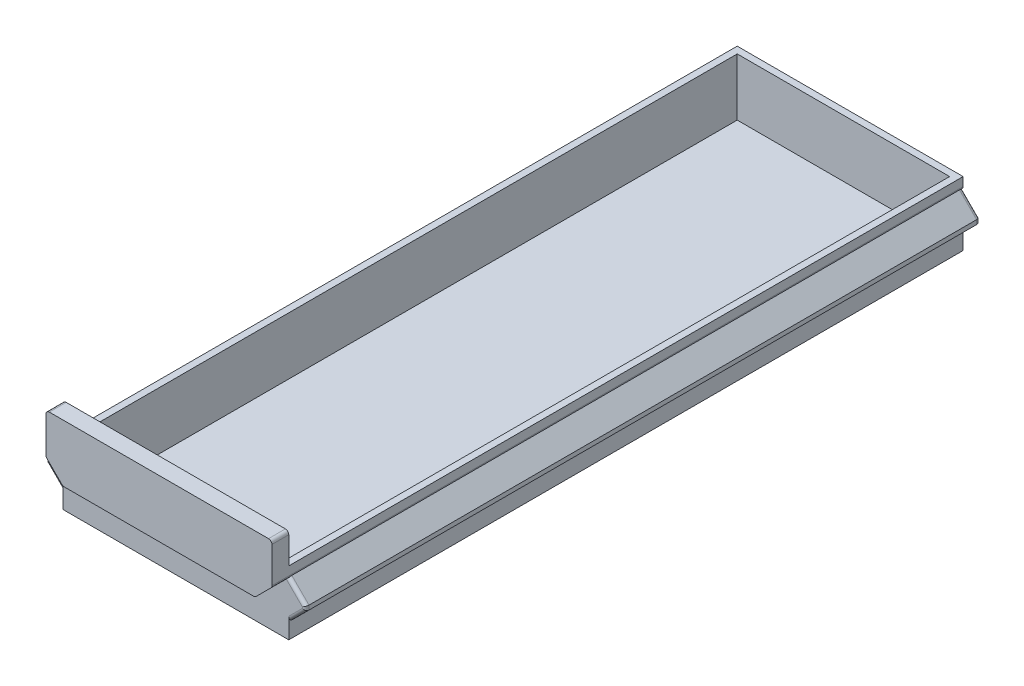
from build123d import *

# Parameters (mm, degrees)
EXTRUDE_1_DEPTH     = 200
SKETCH_2_W          = 63
SKETCH_2_H          = 196
CUT_EXTRUDE_1_DEPTH = 17
SKETCH_4_W          = 67
SKETCH_4_H          = 17
EXTRUDE_2_DEPTH     = 5
CHAMFER_1_SIZE      = 5
FILLET_1_R          = 1
FILLET_3_R          = 1


with BuildPart() as part:
    # 草图1 → 凸台-拉伸1 (new body)
    with BuildSketch(Plane.XY):
        Polygon((-6, 28), (-73, 28), (-73, 32.656854249), (-78, 37.656854249), (-78, 38.928932188), (-73, 43.928932188), (-73, 47), (-6, 47), (-6, 43.928932188), (-1, 38.928932188), (-1, 37.656854249), (-6, 32.656854249), align=None)
    extrude(amount=-EXTRUDE_1_DEPTH)

    # 草图2 → 切除-拉伸1 (cut)
    with BuildSketch(Plane(origin=(0, 47, 0), x_dir=(1, 0, 0), z_dir=(0, 1, 0))):
        with Locations((-39.5, 100)):
            Rectangle(SKETCH_2_W, SKETCH_2_H)
    extrude(amount=-CUT_EXTRUDE_1_DEPTH, mode=Mode.SUBTRACT)

    # 草图4 → 凸台-拉伸2 (add)
    with BuildSketch(Plane.XY):
        with Locations((-39.5, 47.5)):
            Rectangle(SKETCH_4_W, SKETCH_4_H)
    extrude(amount=EXTRUDE_2_DEPTH)

    # 倒角1
    chamfer_1_edges = [part.edges().sort_by_distance(p)[0] for p in [
        (-73, 39, 2.5),
        (-6, 39, 2.5),
    ]]
    chamfer(chamfer_1_edges, length=CHAMFER_1_SIZE)

    # 圆角1
    fillet_1_edges = [part.edges().sort_by_distance(p)[0] for p in [
        (-68, 39, 2.5),
        (-73, 44, -97.5),
        (-11, 39, 2.5),
        (-6, 44, -97.5),
        (-6, 56, 2.5),
        (-73, 56, 2.5),
    ]]
    fillet(fillet_1_edges, radius=FILLET_1_R)

    # 圆角3
    fillet_3_edges = [part.edges().sort_by_distance(p)[0] for p in [
        (-75.5, 35.156854249, 0),
        (-75.457984297, 41.470947892, 0),
        (-78, 38.292893219, 0),
        (-75.5, 35.156854249, -200),
        (-78, 38.292893219, -200),
        (-75.457984297, 41.470947892, -200),
        (-3.5, 35.156854249, -200),
        (-1, 38.292893219, -200),
        (-3.542015703, 41.470947892, -200),
        (-3.5, 35.156854249, 0),
        (-1, 38.292893219, 0),
        (-3.542015703, 41.470947892, 0),
    ]]
    fillet(fillet_3_edges, radius=FILLET_3_R)


solid = part.part
